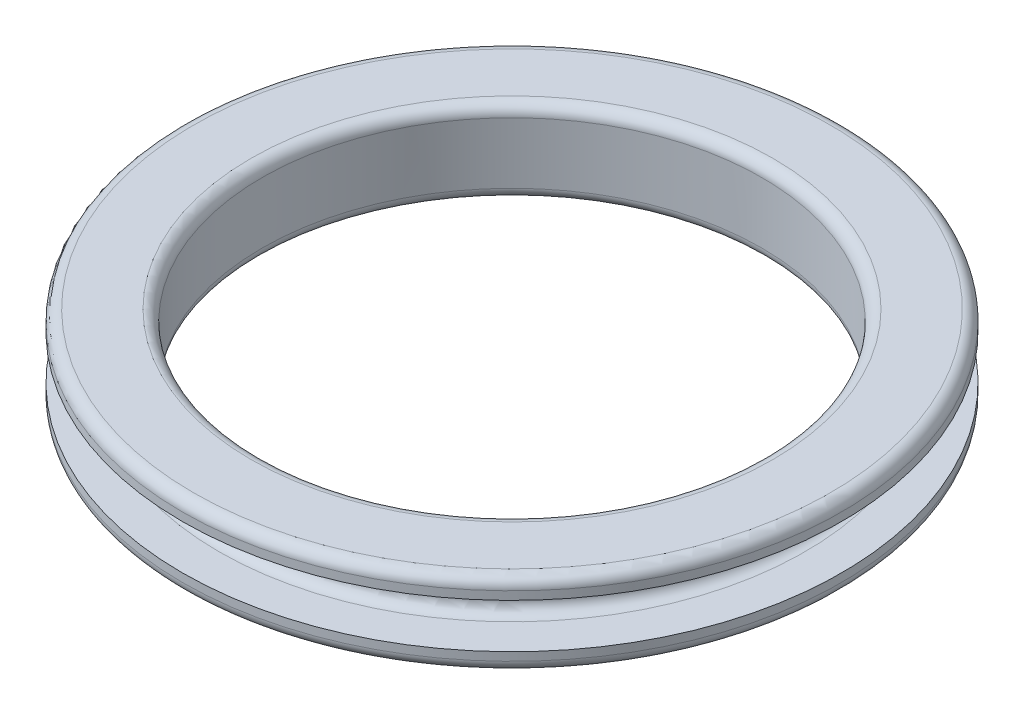
from build123d import *

# Parameters (mm, degrees)
FILLET1_R = 0.4


with BuildPart() as part:
    # Sketch1 → Revolve1 (revolve)
    with BuildSketch(Plane.XY, mode=Mode.PRIVATE) as revolve1_sk:
        Polygon((-9, 0), (-9, 3), (-11.87175241, 3), (-11.87175241, 2.3), (-10.153413472, 2.3), (-10.153413472, 0.7), (-11.87175241, 0.7), (-11.87175241, 0), align=None)
    revolve(revolve1_sk.sketch.rotate(Axis((0, 7.246866229, 0), (0, -1, 0)), 270), axis=Axis((0, 7.246866229, 0), (0, -1, 0)))

    # Fillet1
    fillet1_edges = [part.edges().sort_by_distance(p)[0] for p in [
        (0, 0, -11.87175241),
        (0, 0.7, -10.153413472),
        (0, 2.3, -10.153413472),
        (0, 3, -11.87175241),
        (0, 3, -9),
        (0, 0, -9),
    ]]
    fillet(fillet1_edges, radius=FILLET1_R)


solid = part.part
